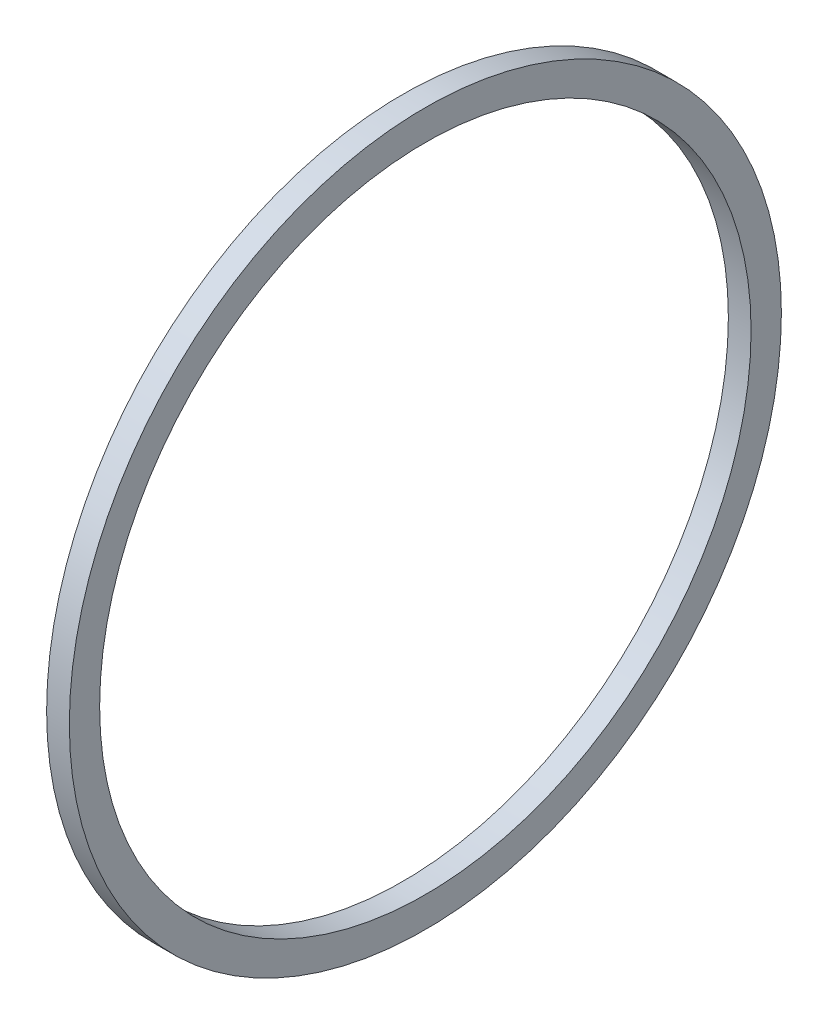
from build123d import *

# Parameters (mm, degrees)
SKETCH1_R           = 47
SKETCH1_R_2         = 43
BOSS_EXTRUDE1_DEPTH = 3


with BuildPart() as part:
    # Sketch1 → Boss-Extrude1 (new body)
    with BuildSketch(Plane(origin=(0, 0, 0), x_dir=(0, 0, -1), z_dir=(1, 0, 0))):
        Circle(SKETCH1_R)
        Circle(SKETCH1_R_2, mode=Mode.SUBTRACT)
    extrude(amount=BOSS_EXTRUDE1_DEPTH)


solid = part.part
